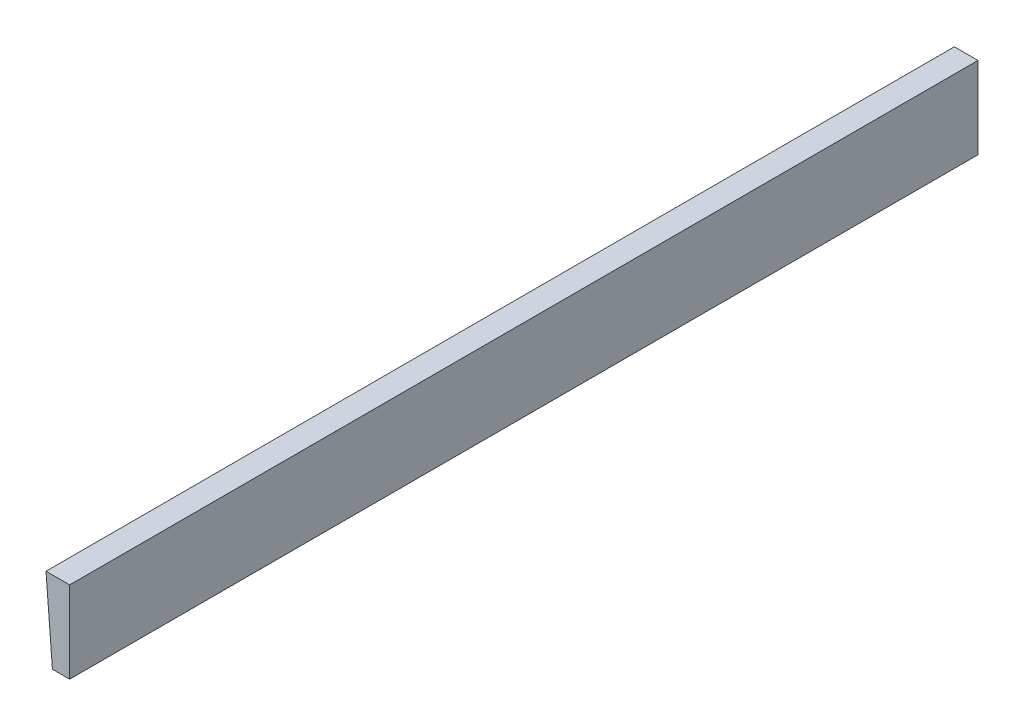
from build123d import *

# Parameters (mm, degrees)
BOSS_EXTRUDE1_DEPTH = 111.1875


with BuildPart() as part:
    # Sketch1 → Boss-Extrude1 (new, symmetric)
    with BuildSketch(Plane.XY):
        Polygon((-5, 10), (-4.212982932, 0), (0, 0), (0, 10), (0, 20), (-5.787017068, 20), align=None)
    extrude(amount=BOSS_EXTRUDE1_DEPTH, both=True)


solid = part.part
